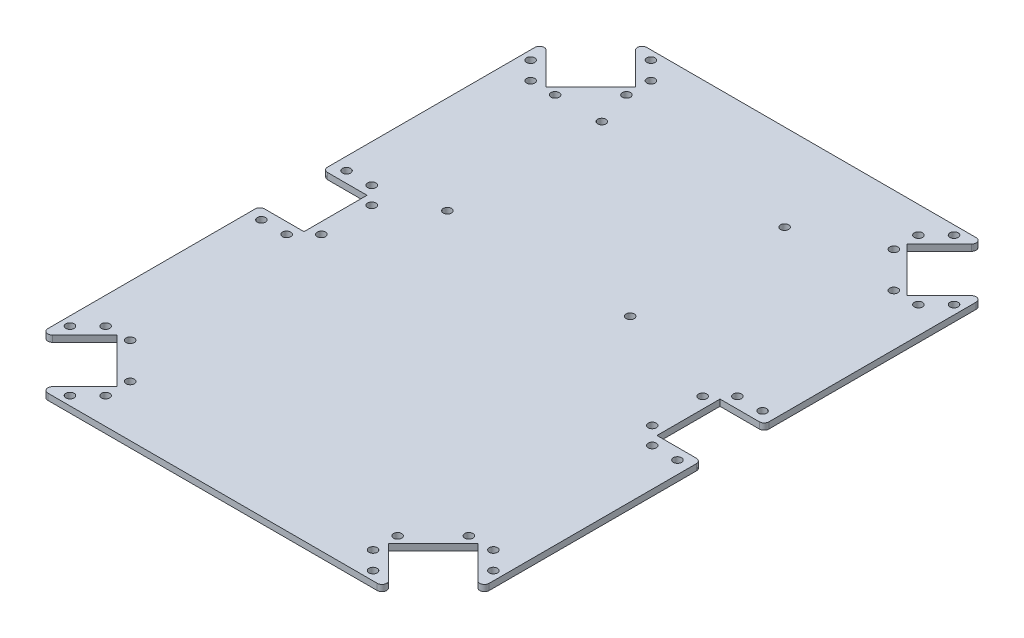
from build123d import *

# Parameters (mm, degrees)
SKETCH2_W           = 140
SKETCH2_H           = 190
SKETCH2_R           = 1.3
BOSS_EXTRUDE1_DEPTH = 2
SKETCH3_W           = 14
SKETCH3_H           = 20
CUT_EXTRUDE1_DEPTH  = 2
FILLET1_R           = 1.5
SKETCH4_R           = 1.3
CUT_EXTRUDE2_DEPTH  = 2


with BuildPart() as part:
    # Sketch2 → Boss-Extrude1 (new body)
    with BuildSketch(Plane(origin=(0, 0, 0), x_dir=(1, 0, 0), z_dir=(0, 1, 0))):
        Rectangle(SKETCH2_W, SKETCH2_H)
        with Locations(Location((42.422835534, 78.736544033, 0), (0, 0, 270))):
            Circle(SKETCH2_R, mode=Mode.SUBTRACT)
        with Locations(Location((42.422835534, 86.514718626, 0), (0, 0, 270))):
            Circle(SKETCH2_R, mode=Mode.SUBTRACT)
        with Locations(Location((48.079689783, 92.171572875, 0), (0, 0, 270))):
            Circle(SKETCH2_R, mode=Mode.SUBTRACT)
        with Locations(Location((66, 13.5, 0), (0, 0, 270))):
            Circle(SKETCH2_R, mode=Mode.SUBTRACT)
        with Locations(Location((58, 13.5, 0), (0, 0, 270))):
            Circle(SKETCH2_R, mode=Mode.SUBTRACT)
        with Locations(Location((52.5, 8, 0), (0, 0, 270))):
            Circle(SKETCH2_R, mode=Mode.SUBTRACT)
        with Locations(Location((52.5, -8, 0), (0, 0, 90))):
            Circle(SKETCH2_R, mode=Mode.SUBTRACT)
        with Locations(Location((58, -13.5, 0), (0, 0, 90))):
            Circle(SKETCH2_R, mode=Mode.SUBTRACT)
        with Locations(Location((66, -13.5, 0), (0, 0, 90))):
            Circle(SKETCH2_R, mode=Mode.SUBTRACT)
        with Locations(Location((67.171572875, 73.079689783, 0), (0, 0, 90))):
            Circle(SKETCH2_R, mode=Mode.SUBTRACT)
        with Locations(Location((61.514718626, 67.422835534, 0), (0, 0, 90))):
            Circle(SKETCH2_R, mode=Mode.SUBTRACT)
        with Locations(Location((53.736544033, 67.422835534, 0), (0, 0, 90))):
            Circle(SKETCH2_R, mode=Mode.SUBTRACT)
        with Locations(Location((67.171572875, -73.079689783, 0), (0, 0, 270))):
            Circle(SKETCH2_R, mode=Mode.SUBTRACT)
        with Locations(Location((61.514718626, -67.422835534, 0), (0, 0, 270))):
            Circle(SKETCH2_R, mode=Mode.SUBTRACT)
        with Locations(Location((53.736544033, -67.422835534, 0), (0, 0, 270))):
            Circle(SKETCH2_R, mode=Mode.SUBTRACT)
        with Locations(Location((48.079689783, -92.171572875, 0), (0, 0, 90))):
            Circle(SKETCH2_R, mode=Mode.SUBTRACT)
        with Locations(Location((42.422835534, -86.514718626, 0), (0, 0, 90))):
            Circle(SKETCH2_R, mode=Mode.SUBTRACT)
        with Locations(Location((42.422835534, -78.736544033, 0), (0, 0, 90))):
            Circle(SKETCH2_R, mode=Mode.SUBTRACT)
        with Locations(Location((-48.079689783, 92.171572875, 0), (0, 0, 90))):
            Circle(SKETCH2_R, mode=Mode.SUBTRACT)
        with Locations(Location((-42.422835534, 86.514718626, 0), (0, 0, 90))):
            Circle(SKETCH2_R, mode=Mode.SUBTRACT)
        with Locations(Location((-42.422835534, 78.736544033, 0), (0, 0, 90))):
            Circle(SKETCH2_R, mode=Mode.SUBTRACT)
        with Locations(Location((-67.171572875, 73.079689783, 0), (0, 0, 270))):
            Circle(SKETCH2_R, mode=Mode.SUBTRACT)
        with Locations(Location((-61.514718626, 67.422835534, 0), (0, 0, 270))):
            Circle(SKETCH2_R, mode=Mode.SUBTRACT)
        with Locations(Location((-53.736544033, 67.422835534, 0), (0, 0, 270))):
            Circle(SKETCH2_R, mode=Mode.SUBTRACT)
        with Locations(Location((-67.171572875, -73.079689783, 0), (0, 0, 90))):
            Circle(SKETCH2_R, mode=Mode.SUBTRACT)
        with Locations(Location((-61.514718626, -67.422835534, 0), (0, 0, 90))):
            Circle(SKETCH2_R, mode=Mode.SUBTRACT)
        with Locations(Location((-53.736544033, -67.422835534, 0), (0, 0, 90))):
            Circle(SKETCH2_R, mode=Mode.SUBTRACT)
        with Locations(Location((-42.422835534, -78.736544033, 0), (0, 0, 270))):
            Circle(SKETCH2_R, mode=Mode.SUBTRACT)
        with Locations(Location((-42.422835534, -86.514718626, 0), (0, 0, 270))):
            Circle(SKETCH2_R, mode=Mode.SUBTRACT)
        with Locations(Location((-48.079689783, -92.171572875, 0), (0, 0, 270))):
            Circle(SKETCH2_R, mode=Mode.SUBTRACT)
        with Locations(Location((-52.5, -8, 0), (0, 0, 270))):
            Circle(SKETCH2_R, mode=Mode.SUBTRACT)
        with Locations(Location((-58, -13.5, 0), (0, 0, 270))):
            Circle(SKETCH2_R, mode=Mode.SUBTRACT)
        with Locations(Location((-66, -13.5, 0), (0, 0, 270))):
            Circle(SKETCH2_R, mode=Mode.SUBTRACT)
        with Locations(Location((-66, 13.5, 0), (0, 0, 90))):
            Circle(SKETCH2_R, mode=Mode.SUBTRACT)
        with Locations(Location((-58, 13.5, 0), (0, 0, 90))):
            Circle(SKETCH2_R, mode=Mode.SUBTRACT)
        with Locations(Location((-52.5, 8, 0), (0, 0, 90))):
            Circle(SKETCH2_R, mode=Mode.SUBTRACT)
    extrude(amount=BOSS_EXTRUDE1_DEPTH)

    # Sketch3 → Cut-Extrude1 (cut)
    with BuildSketch(Plane(origin=(0, 2, 0), x_dir=(1, 0, 0), z_dir=(0, 1, 0))):
        with Locations((63, 0)):
            Rectangle(SKETCH3_W, SKETCH3_H)
        Polygon((55.857864376, 95), (43.129942315, 82.272077939), (57.272077939, 68.129942315), (70, 80.857864376), (70, 95), align=None)
        Polygon((70, -80.857864376), (70, -95), (55.857864376, -95), (43.129942315, -82.272077939), (57.272077939, -68.129942315), align=None)
        Polygon((-70, 80.857864376), (-70, 95), (-55.857864376, 95), (-43.129942315, 82.272077939), (-57.272077939, 68.129942315), align=None)
        with Locations((-63, 0)):
            Rectangle(SKETCH3_W, SKETCH3_H)
        Polygon((-57.272077939, -68.129942315), (-70, -80.857864376), (-70, -95), (-55.857864376, -95), (-43.129942315, -82.272077939), align=None)
    extrude(amount=-CUT_EXTRUDE1_DEPTH, mode=Mode.SUBTRACT)

    # Fillet1
    fillet1_edges = [part.edges().sort_by_distance(p)[0] for p in [
        (55.857864376, 1, -95),
        (70, 1, -80.857864376),
        (70, 1, 80.857864376),
        (55.857864376, 1, 95),
        (-70, 1, -80.857864376),
        (-55.857864376, 1, -95),
        (-70, 1, 10),
        (-70, 1, -10),
        (-55.857864376, 1, 95),
        (-70, 1, 80.857864376),
        (70, 1, -10),
        (70, 1, 10),
    ]]
    fillet(fillet1_edges, radius=FILLET1_R)

    # Sketch4 → Cut-Extrude2 (cut)
    with BuildSketch(Plane(origin=(0, 2, 0), x_dir=(1, 0, 0), z_dir=(0, 1, 0))):
        with Locations(Location((-39, 67.5, 0), (0, 0, 270))):
            Circle(SKETCH4_R)
        with Locations(Location((19, 67.5, 0), (0, 0, 270))):
            Circle(SKETCH4_R)
        with Locations(Location((19, 18.5, 0), (0, 0, 270))):
            Circle(SKETCH4_R)
        with Locations(Location((-39, 18.5, 0), (0, 0, 270))):
            Circle(SKETCH4_R)
    extrude(amount=-CUT_EXTRUDE2_DEPTH, mode=Mode.SUBTRACT)


solid = part.part
